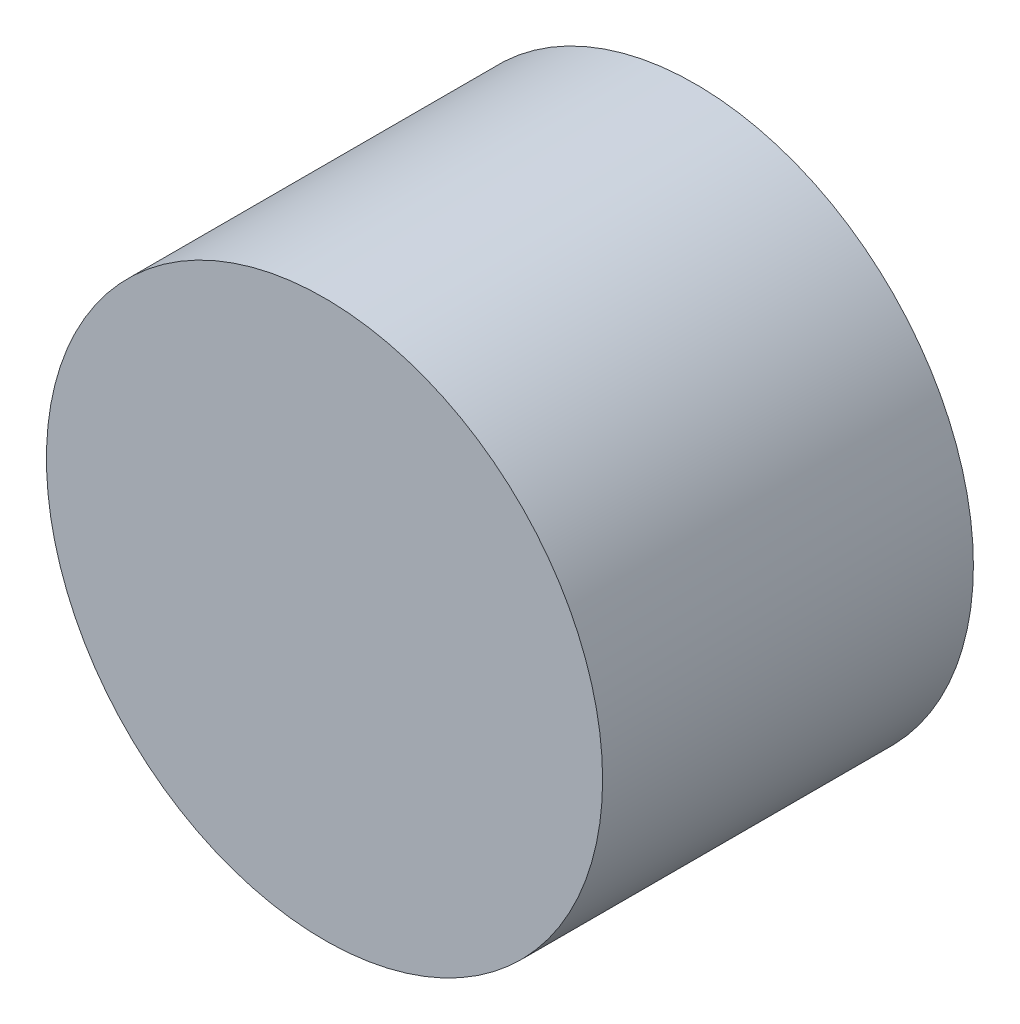
from build123d import *

# Parameters (mm, degrees)
SKETCH1_R      = 4.7625
EXTRUDE1_DEPTH = 6.35


with BuildPart() as part:
    # Sketch1 → Extrude1 (new body)
    with BuildSketch(Plane.XY):
        Circle(SKETCH1_R)
    extrude(amount=EXTRUDE1_DEPTH)


solid = part.part
